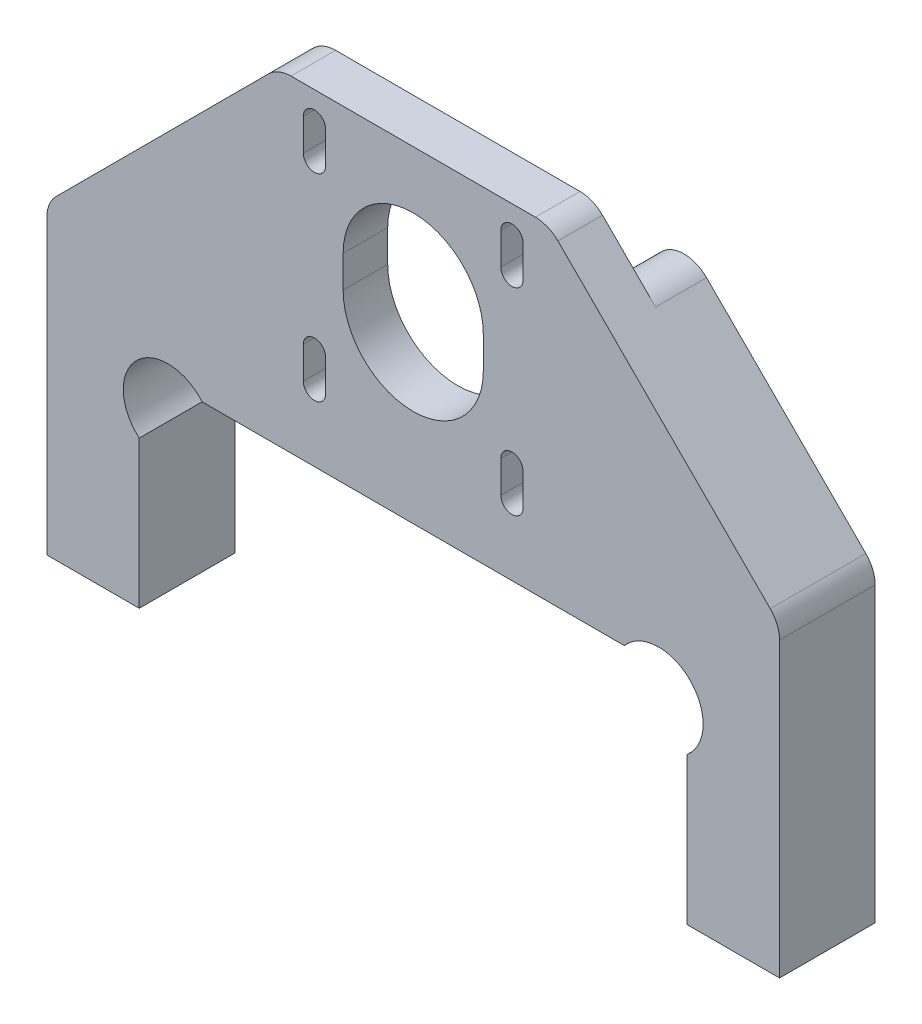
from build123d import *

# Parameters (mm, degrees)
AUFSATZ_LINEAR_AUSTRAGEN1_DEPTH = 15
M5_GEWINDEBOHRUNG1_D            = 4.2
M5_GEWINDEBOHRUNG1_DEPTH        = 14
M5_GEWINDEBOHRUNG1_TIP          = 1.2618073
SKIZZE4_W                       = 45
SKIZZE4_H                       = 51.25
SCHNITT_LINEAR_AUSTRAGEN1_DEPTH = 8
VERRUNDUNG1_R                   = 5
VERRUNDUNG2_R                   = 5
M3_GEWINDEBOHRUNG1_D            = 2.5
M3_GEWINDEBOHRUNG1_DEPTH        = 8.5
M3_GEWINDEBOHRUNG1_TIP          = 0.751075774


with BuildPart() as part:
    # Skizze1 → Aufsatz-Linear austragen1 (new body)
    with BuildSketch(Plane.XY):
        with BuildLine():
            Line((100.5, 0), (115, 0))
            Line((115, 0), (115, 48))
            Line((115, 48), (78.75, 84.25))
            Line((78.75, 84.25), (36.25, 84.25))
            Line((36.25, 84.25), (0, 48))
            Line((0, 48), (0, 0))
            Line((0, 0), (14.5, 0))
            Line((14.5, 0), (14.5, 23.138097353))
            ThreePointArc((14.5, 23.138097353), (14.050252532, 33.449747468), (24.361902647, 33))
            Line((24.361902647, 33), (90.638097353, 33))
            ThreePointArc((90.638097353, 33), (100.949747468, 33.449747468), (100.5, 23.138097353))
            Line((100.5, 23.138097353), (100.5, 0))
        make_face()
        with BuildLine():
            Line((68.5, 64.25), (68.5, 59.25))
            ThreePointArc((68.5, 59.25), (57.5, 48.25), (46.5, 59.25))
            Line((46.5, 59.25), (46.5, 64.25))
            ThreePointArc((46.5, 64.25), (57.5, 75.25), (68.5, 64.25))
        make_face(mode=Mode.SUBTRACT)
        with BuildLine():
            Line((43.75, 79.75), (43.75, 74.75))
            ThreePointArc((43.75, 74.75), (42, 73), (40.25, 74.75))
            Line((40.25, 74.75), (40.25, 79.75))
            ThreePointArc((40.25, 79.75), (42, 81.5), (43.75, 79.75))
        make_face(mode=Mode.SUBTRACT)
        with BuildLine():
            Line((74.75, 79.75), (74.75, 74.75))
            ThreePointArc((74.75, 74.75), (73, 73), (71.25, 74.75))
            Line((71.25, 74.75), (71.25, 79.75))
            ThreePointArc((71.25, 79.75), (73, 81.5), (74.75, 79.75))
        make_face(mode=Mode.SUBTRACT)
        with BuildLine():
            Line((74.75, 48.75), (74.75, 43.75))
            ThreePointArc((74.75, 43.75), (73, 42), (71.25, 43.75))
            Line((71.25, 43.75), (71.25, 48.75))
            ThreePointArc((71.25, 48.75), (73, 50.5), (74.75, 48.75))
        make_face(mode=Mode.SUBTRACT)
        with BuildLine():
            Line((43.75, 48.75), (43.75, 43.75))
            ThreePointArc((43.75, 43.75), (42, 42), (40.25, 43.75))
            Line((40.25, 43.75), (40.25, 48.75))
            ThreePointArc((40.25, 48.75), (42, 50.5), (43.75, 48.75))
        make_face(mode=Mode.SUBTRACT)
    extrude(amount=AUFSATZ_LINEAR_AUSTRAGEN1_DEPTH)

    # M5 Gewindebohrung1
    with Locations(Plane(origin=(0, 0, 0), x_dir=(-1, 0, 0), z_dir=(0, -1, 0))):
        with Locations((-7.5, -7.5), (-107.5, -7.5)):
            Hole(M5_GEWINDEBOHRUNG1_D / 2, depth=M5_GEWINDEBOHRUNG1_DEPTH)
            with Locations((0, 0, -(M5_GEWINDEBOHRUNG1_DEPTH + M5_GEWINDEBOHRUNG1_TIP / 2))):  # 118° drill point
                Cone(0, M5_GEWINDEBOHRUNG1_D / 2, M5_GEWINDEBOHRUNG1_TIP, mode=Mode.SUBTRACT)

    # Skizze4 → Schnitt-Linear austragen1 (cut)
    with BuildSketch(Plane(origin=(0, 0, 0), x_dir=(-1, 0, 0), z_dir=(0, 0, -1))):
        with Locations((-57.5, 58.625)):
            Rectangle(SKIZZE4_W, SKIZZE4_H)
    extrude(amount=-SCHNITT_LINEAR_AUSTRAGEN1_DEPTH, mode=Mode.SUBTRACT)

    # Verrundung1
    verrundung1_edges = [part.edges().sort_by_distance(p)[0] for p in [
        (35, 83, 4),
        (80, 83, 4),
    ]]
    fillet(verrundung1_edges, radius=VERRUNDUNG1_R)

    # Verrundung2
    verrundung2_edges = [part.edges().sort_by_distance(p)[0] for p in [
        (0, 48, 7.5),
        (36.25, 84.25, 11.5),
        (78.75, 84.25, 11.5),
        (115, 48, 7.5),
    ]]
    fillet(verrundung2_edges, radius=VERRUNDUNG2_R)

    # M3 Gewindebohrung1
    with Locations(Plane(origin=(0, 0, 0), x_dir=(-1, 0, 0), z_dir=(0, 0, -1))):
        with Locations((-3.5, 37.7), (-22.5, 37.7)):
            Hole(M3_GEWINDEBOHRUNG1_D / 2, depth=M3_GEWINDEBOHRUNG1_DEPTH)
            with Locations((0, 0, -(M3_GEWINDEBOHRUNG1_DEPTH + M3_GEWINDEBOHRUNG1_TIP / 2))):  # 118° drill point
                Cone(0, M3_GEWINDEBOHRUNG1_D / 2, M3_GEWINDEBOHRUNG1_TIP, mode=Mode.SUBTRACT)


solid = part.part
